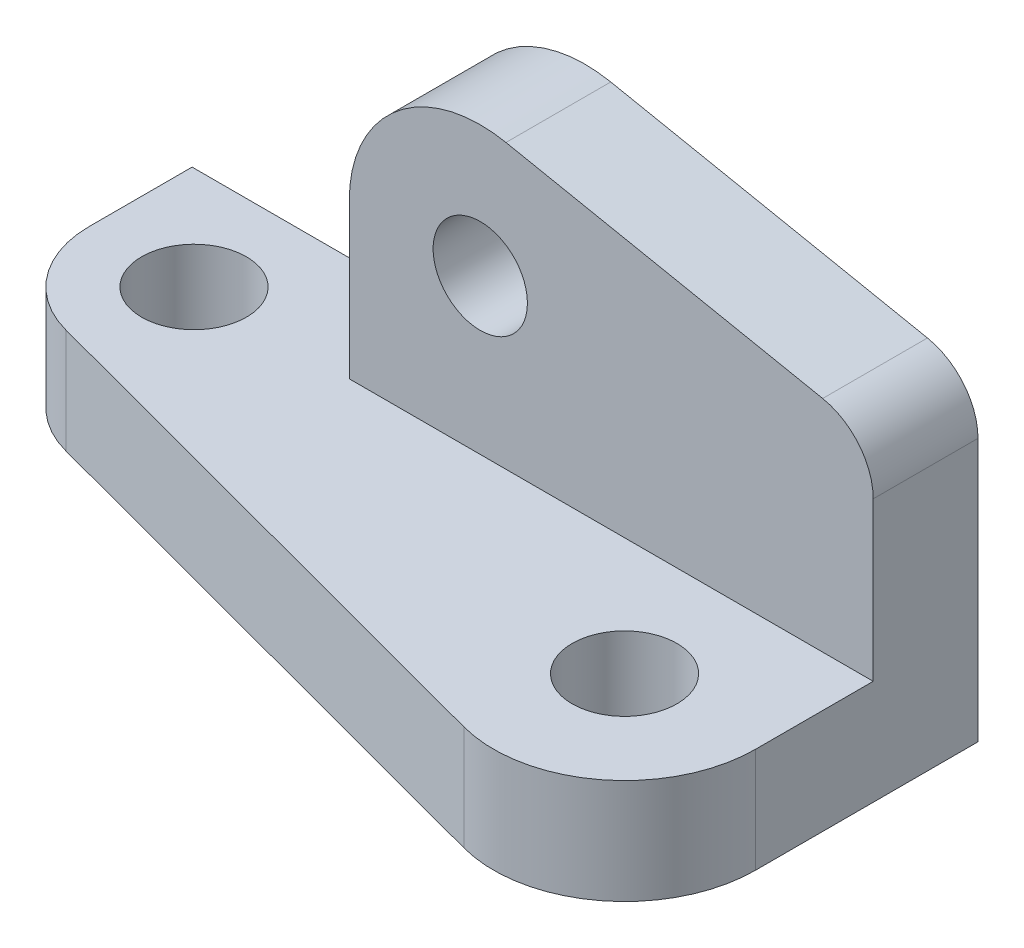
from build123d import *

# Parameters (mm, degrees)
BOSS_EXTRUDE1_DEPTH        = 20
BOSS_EXTRUDE2_DEPTH        = 20
FILLET1_R                  = 20
FILLET2_R                  = 25
FILLET3_R                  = 12
F_20_0_20_DIAMETER_HOLE1_D = 20
F_18_0_18_DIAMETER_HOLE1_D = 18


with BuildPart() as part:
    # Sketch1 → Boss-Extrude1 (new body)
    with BuildSketch(Plane(origin=(0, 0, 0), x_dir=(1, 0, 0), z_dir=(0, 1, 0))):
        Polygon((0, 0), (150, 0), (150, -75), (0, -35), align=None)
    extrude(amount=BOSS_EXTRUDE1_DEPTH)

    # Sketch2 → Boss-Extrude2 (add)
    with BuildSketch(Plane(origin=(0, 0, 0), x_dir=(-1, 0, 0), z_dir=(0, 0, -1))):
        Polygon((-50, 0), (-150, 0), (-150, 60), (-50, 80), align=None)
    extrude(amount=-BOSS_EXTRUDE2_DEPTH)

    # Fillet1
    fillet1_edges = [part.edges().sort_by_distance(p)[0] for p in [
        (0, 10, 35),
    ]]
    fillet(fillet1_edges, radius=FILLET1_R)

    # Fillet2
    fillet2_edges = [part.edges().sort_by_distance(p)[0] for p in [
        (50, 80, 10),
        (150, 10, 75),
    ]]
    fillet(fillet2_edges, radius=FILLET2_R)

    # Fillet3
    fillet3_edges = [part.edges().sort_by_distance(p)[0] for p in [
        (150, 60, 10),
    ]]
    fillet(fillet3_edges, radius=FILLET3_R)

    # Ø20.0 (20) Diameter Hole1 (through all)
    with Locations(Plane(origin=(0, 20, 0), x_dir=(1, 0, 0), z_dir=(0, 1, 0))):
        with Locations((20, -19.634433738), (125, -42.45970884)):
            Hole(F_20_0_20_DIAMETER_HOLE1_D / 2)

    # Ø18.0 (18) Diameter Hole1 (through all)
    with Locations(Plane.XY.offset(20)):
        with Locations((75, 49.504902432)):
            Hole(F_18_0_18_DIAMETER_HOLE1_D / 2)


solid = part.part
